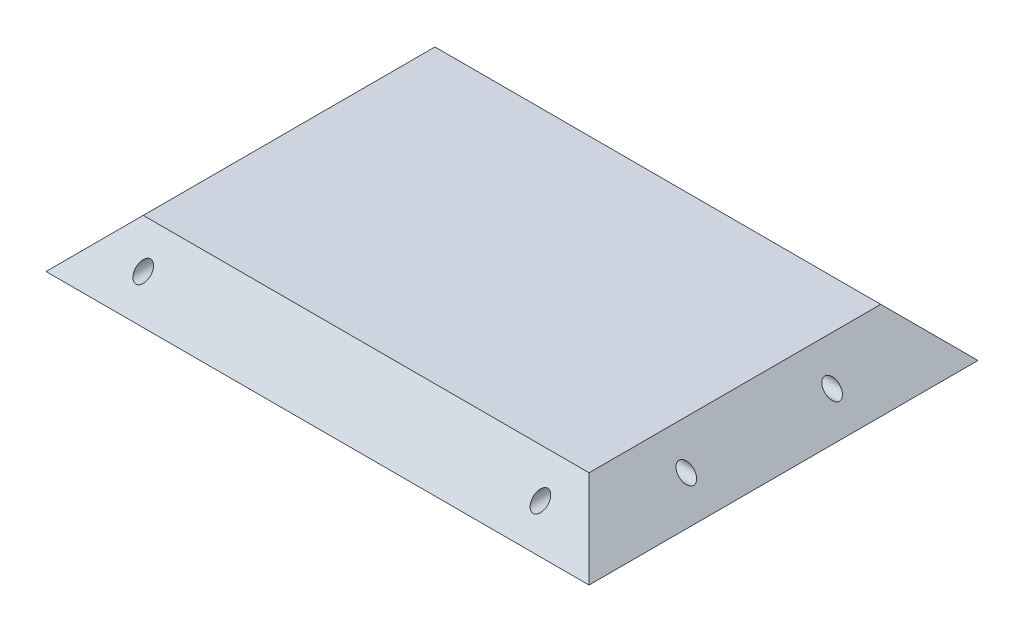
from build123d import *

# Parameters (mm, degrees)
SKETCH_3_R          = 1.5
CUT_EXTRUDE_1_DEPTH = 20
SKETCH_4_R          = 1.5
CUT_EXTRUDE_2_DEPTH = 20


with BuildPart() as part:
    # Эскиз1 → По сечениям1 section 0
    with BuildSketch(Plane(origin=(0, 0, 0), x_dir=(1, 0, 0), z_dir=(0, 1, 0))):
        with BuildLine():
            Line((-55.85, -40), (55.85, -40))
            Line((55.85, -40), (55.85, 40))
            Line((55.85, 40), (-55.85, 40))
            Line((-55.85, 40), (-55.85, -40))
        make_face()
    # Эскиз2 → По сечениям1 section 1
    with BuildSketch(Plane(origin=(0, 10, 0), x_dir=(1, 0, 0), z_dir=(0, 1, 0))):
        with BuildLine():
            Line((45.85, 30), (-45.85, 30))
            Line((-45.85, 30), (-45.85, -30))
            Line((-45.85, -30), (45.85, -30))
            Line((45.85, -30), (45.85, 30))
        make_face()
    loft()

    # Эскиз3 → Вырез-Вытянуть1 (cut)
    with BuildSketch(Plane.XY.offset(40)):
        with Locations((40.85, 5)):
            Circle(SKETCH_3_R)
        with Locations(Location((-40.85, 5, 0), (0, 0, 270))):
            Circle(SKETCH_3_R)
    cut_extrude_1 = extrude(amount=-CUT_EXTRUDE_1_DEPTH, mode=Mode.SUBTRACT)

    # Зеркальное отражение1: Вырез-Вытянуть1 across plane
    add(cut_extrude_1.mirror(Plane.XY), mode=Mode.SUBTRACT)

    # Эскиз4 → Вырез-Вытянуть2 (cut)
    with BuildSketch(Plane(origin=(55.85, 0, 0), x_dir=(0, 0, -1), z_dir=(1, 0, 0))):
        with Locations((-15, 5)):
            Circle(SKETCH_4_R)
        with Locations(Location((15, 5, 0), (0, 0, 270))):
            Circle(SKETCH_4_R)
    cut_extrude_2 = extrude(amount=-CUT_EXTRUDE_2_DEPTH, mode=Mode.SUBTRACT)

    # Зеркальное отражение2: Вырез-Вытянуть2 across plane
    add(cut_extrude_2.mirror(Plane(origin=(0, 0, 0), x_dir=(0, 0, 1), z_dir=(1, 0, 0))), mode=Mode.SUBTRACT)


solid = part.part
